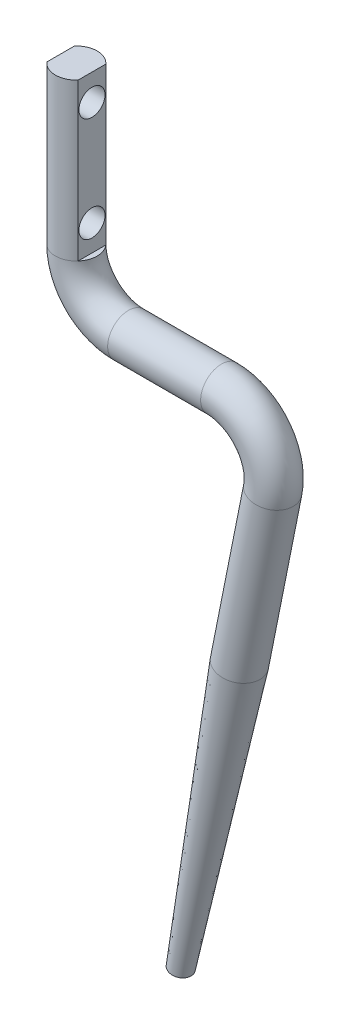
from build123d import *

# Parameters (mm, degrees)
SKETCH3_R             = 4
CHAMFER1_SIZE         = 2
CHAMFER1_SIZE2        = 57.272506566
SKETCH4_OUTSIDE_W     = 77.38
SKETCH4_OUTSIDE_H     = 39.578
SKETCH4_OUTSIDE_W_2   = 6
SKETCH4_OUTSIDE_H_2   = 35.530215116
EXTRUDE1_DEPTH        = 30
M6_TAPPED_HOLE1_D     = 5
M6_TAPPED_HOLE1_DEPTH = 9
M6_TAPPED_HOLE1_TIP   = 1.502151548


with BuildPart() as part:
    # Sweep1: sweep along a path in Sketch1
    with BuildLine(Plane.XY) as sweep1_path:
        Line((0, 40), (0, 10))
        ThreePointArc((0, 10), (2.928932188, 2.928932188), (10, 0))
        Line((10, 0), (27.801960973, 0))
        ThreePointArc((27.801960973, 0), (35.535382386, -3.660110944), (37.60776773, -11.961161351))
        Line((37.60776773, -11.961161351), (20, -100))
    # Sketch3 → Sweep1 (sweep)
    with BuildSketch(Plane(origin=(0, 40, 0), x_dir=(1, 0, 0), z_dir=(0, 1, 0))):
        Circle(SKETCH3_R)
    sweep(path=sweep1_path.line)

    # Chamfer1
    chamfer1_edges = [part.edges().sort_by_distance(p)[0] for p in [
        (16.077677297, -99.215535459, 0),
    ]]
    chamfer1_side = [part.faces().sort_by_distance(p)[0] for p in [
        (20, -100, 0),
    ]]
    chamfer(chamfer1_edges, length=CHAMFER1_SIZE, length2=CHAMFER1_SIZE2, reference=chamfer1_side[0])

    # Sketch4 outside → Extrude1 (cut)
    with BuildSketch(Plane(origin=(0, 40, 0), x_dir=(1, 0, 0), z_dir=(0, 1, 0))):
        with Locations((18.901, 0)):
            Rectangle(SKETCH4_OUTSIDE_W, SKETCH4_OUTSIDE_H)
        Rectangle(SKETCH4_OUTSIDE_W_2, SKETCH4_OUTSIDE_H_2, mode=Mode.SUBTRACT)
    extrude(amount=-EXTRUDE1_DEPTH, mode=Mode.SUBTRACT)

    # M6 Tapped Hole1
    with Locations(Plane(origin=(3, 0, 0), x_dir=(0, 0, -1), z_dir=(1, 0, 0))):
        with Locations((0, 35), (0, 15)):
            Hole(M6_TAPPED_HOLE1_D / 2, depth=M6_TAPPED_HOLE1_DEPTH)
            with Locations((0, 0, -(M6_TAPPED_HOLE1_DEPTH + M6_TAPPED_HOLE1_TIP / 2))):  # 118° drill point
                Cone(0, M6_TAPPED_HOLE1_D / 2, M6_TAPPED_HOLE1_TIP, mode=Mode.SUBTRACT)


solid = part.part
